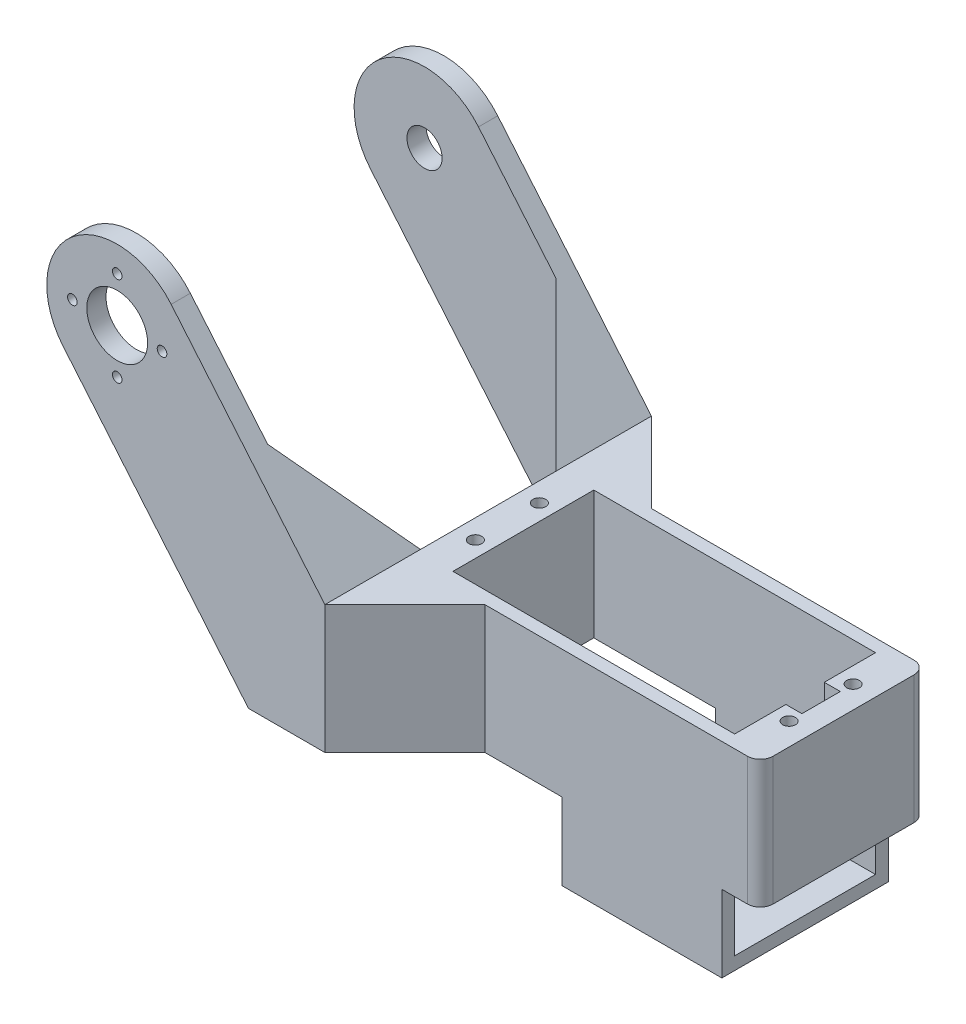
from build123d import *

# Parameters (mm, degrees)
CROQUIS2_W              = 58
CROQUIS2_H              = 26
CROQUIS2_W_2            = 44
CROQUIS2_H_2            = 22
SALIENTE_EXTRUIR3_DEPTH = 20
CROQUIS4_R              = 1
CROQUIS4_W              = 2.5
CROQUIS4_H              = 6
CUT_EXTRUDE1_DEPTH      = 39.327535793
SKETCH1_W               = 51
SKETCH1_H               = 20
BOSS_EXTRUDE1_DEPTH     = 2.5
CROQUIS6_R              = 4.75
CROQUIS6_R_2            = 0.75
SALIENTE_EXTRUIR5_DEPTH = 3
BOSS_EXTRUDE2_START     = -3
SKETCH3_R               = 2.75
BOSS_EXTRUDE2_DEPTH     = 3
BOSS_EXTRUDE3_DEPTH     = 25
FILLET1_R               = 2
SKETCH6_R               = 2.15
BOSS_EXTRUDE4_DEPTH     = 5
FILLET4_R               = 1
BOSS_EXTRUDE5_DEPTH     = 20
BOSS_EXTRUDE6_REACH     = 93.885
CUT_EXTRUDE2_DEPTH      = 84.971155352


with BuildPart() as part:
    # Croquis2 → Saliente-Extruir3 (new body)
    with BuildSketch(Plane(origin=(0, 0, 0), x_dir=(1, 0, 0), z_dir=(0, 1, 0))):
        with Locations((-1, 0)):
            Rectangle(CROQUIS2_W, CROQUIS2_H)
        Rectangle(CROQUIS2_W_2, CROQUIS2_H_2, mode=Mode.SUBTRACT)
    extrude(amount=SALIENTE_EXTRUIR3_DEPTH)

    # Croquis4 → Cut-Extrude1 (cut, through all)
    with BuildSketch(Plane(origin=(0, 20, 0), x_dir=(1, 0, 0), z_dir=(0, 1, 0))):
        with Locations(Location((-24.5, 5, 0), (0, 0, 270))):
            Circle(CROQUIS4_R)
        with Locations(Location((-24.5, -5, 0), (0, 0, 270))):
            Circle(CROQUIS4_R)
        with Locations(Location((24.5, -5, 0), (0, 0, 90))):
            Circle(CROQUIS4_R)
        with Locations(Location((24.5, 5, 0), (0, 0, 90))):
            Circle(CROQUIS4_R)
        with Locations((23.25, 0)):
            Rectangle(CROQUIS4_W, CROQUIS4_H)
    extrude(amount=-CUT_EXTRUDE1_DEPTH, mode=Mode.SUBTRACT)

    # Sketch1 → Boss-Extrude1 (add)
    with BuildSketch(Plane.ZY.offset(30)):
        with Locations((0, 10)):
            Rectangle(SKETCH1_W, SKETCH1_H)
    extrude(amount=-BOSS_EXTRUDE1_DEPTH)

    # Croquis6 → Saliente-Extruir5 (add)
    with BuildSketch(Plane.XY.offset(25.5)):
        with BuildLine():
            Line((-39.436967742, 0), (-30, 0))
            Line((-30, 0), (-30, 20))
            Line((-30, 20), (-27.5, 20))
            Line((-27.5, 20), (-51.509432429, 48.613327353))
            ThreePointArc((-51.509432429, 48.613327353), (-67.00658501, 49.969152521), (-68.362410178, 34.47199994))
            Line((-68.362410178, 34.47199994), (-39.436967742, 0))
        make_face()
        with Locations((-59.935921303, 41.542663647)):
            Circle(CROQUIS6_R, mode=Mode.SUBTRACT)
        with Locations((-59.935921303, 34.542663647)):
            Circle(CROQUIS6_R_2, mode=Mode.SUBTRACT)
        with Locations((-52.935921303, 41.542663647)):
            Circle(CROQUIS6_R_2, mode=Mode.SUBTRACT)
        with Locations((-66.935921303, 41.542663647)):
            Circle(CROQUIS6_R_2, mode=Mode.SUBTRACT)
        with Locations((-59.935921303, 48.542663647)):
            Circle(CROQUIS6_R_2, mode=Mode.SUBTRACT)
    extrude(amount=-SALIENTE_EXTRUIR5_DEPTH)

    # Sketch3 → Boss-Extrude2 (add)
    with BuildSketch(Plane(origin=(0, 0, -25.5), x_dir=(-1, 0, 0), z_dir=(0, 0, -1)).offset(BOSS_EXTRUDE2_START)):
        with BuildLine():
            Line((51.509432429, 48.613327353), (27.5, 20))
            Line((27.5, 20), (30, 20))
            Line((30, 20), (30, 0))
            Line((30, 0), (39.436967742, 0))
            Line((39.436967742, 0), (68.362410178, 34.47199994))
            ThreePointArc((68.362410178, 34.47199994), (67.00658501, 49.969152521), (51.509432429, 48.613327353))
        make_face()
        with Locations((59.935921303, 41.542663647)):
            Circle(SKETCH3_R, mode=Mode.SUBTRACT)
    extrude(amount=BOSS_EXTRUDE2_DEPTH)

    # Sketch5 → Boss-Extrude3 (add)
    with BuildSketch(Plane(origin=(22, 0, 0), x_dir=(0, 0, -1), z_dir=(1, 0, 0))):
        Polygon((-13, 0), (-13, -12), (13, -12), (13, 0), (11, 0), (11, -10), (-11, -10), (-11, 0), align=None)
    extrude(amount=-BOSS_EXTRUDE3_DEPTH)

    # Fillet1
    fillet1_edges = [part.edges().sort_by_distance(p)[0] for p in [
        (28, 10, -13),
        (28, 10, 13),
    ]]
    fillet(fillet1_edges, radius=FILLET1_R)

    # Sketch6 → Boss-Extrude4 (add)
    with BuildSketch(Plane.XZ.offset(12)):
        with Locations(Location((10, 0, 0), (0, 0, 270))):
            Circle(SKETCH6_R)
    extrude(amount=BOSS_EXTRUDE4_DEPTH)

    # Fillet4
    fillet4_edges = [part.edges().sort_by_distance(p)[0] for p in [
        (10, -12, 2.15),
    ]]
    fillet(fillet4_edges, radius=FILLET4_R)

    # Sketch8 → Boss-Extrude5 (add)
    with BuildSketch(Plane(origin=(0, 20, 0), x_dir=(1, 0, 0), z_dir=(0, 1, 0))):
        Polygon((-27.5, 25.5), (-27.5, 13), (-15, 13), align=None)
        Polygon((-27.5, -13), (-15, -13), (-27.5, -25.5), align=None)
    extrude(amount=-BOSS_EXTRUDE5_DEPTH)

    # Boss-Extrude6: up to this plane
    boss_extrude6_end = Plane(origin=(-6.289584913, -5.277588381, 22.5), z_dir=(0.76604444311898, 0.642787609686537, 0))
    # Sketch9 → Boss-Extrude6 (add, up to the surface)
    with BuildSketch(Plane.XZ, mode=Mode.PRIVATE) as boss_extrude6_sk1:
        Polygon((-39.436967742, 22.5), (-26.5, 9.563032258), (-26.5, 22.5), align=None)
    boss_extrude6_tool1 = split(extrude(boss_extrude6_sk1.sketch, amount=-BOSS_EXTRUDE6_REACH, mode=Mode.PRIVATE), bisect_by=boss_extrude6_end, keep=Keep.BOTH, mode=Mode.PRIVATE)
    add(boss_extrude6_tool1.solids().sort_by_distance((-30.812323, 0, 18.187677))[0])
    # Sketch9 → Boss-Extrude6 (add, up to the surface)
    with BuildSketch(Plane.XZ, mode=Mode.PRIVATE) as boss_extrude6_sk2:
        Polygon((-26.5, -9.563032258), (-26.5, -22.5), (-39.436967742, -22.5), align=None)
    boss_extrude6_tool2 = split(extrude(boss_extrude6_sk2.sketch, amount=-BOSS_EXTRUDE6_REACH, mode=Mode.PRIVATE), bisect_by=boss_extrude6_end, keep=Keep.BOTH, mode=Mode.PRIVATE)
    add(boss_extrude6_tool2.solids().sort_by_distance((-30.812323, 0, -18.187677))[0])

    # Sketch10 → Cut-Extrude2 (cut, through all)
    with BuildSketch(Plane(origin=(0, 20, 0), x_dir=(1, 0, 0), z_dir=(0, 1, 0))):
        Polygon((-30, 13.063032258), (-30, -13.063032258), (-27.5, -10.563032258), (-27.5, 10.563032258), align=None)
    extrude(amount=-CUT_EXTRUDE2_DEPTH, mode=Mode.SUBTRACT)


solid = part.part
